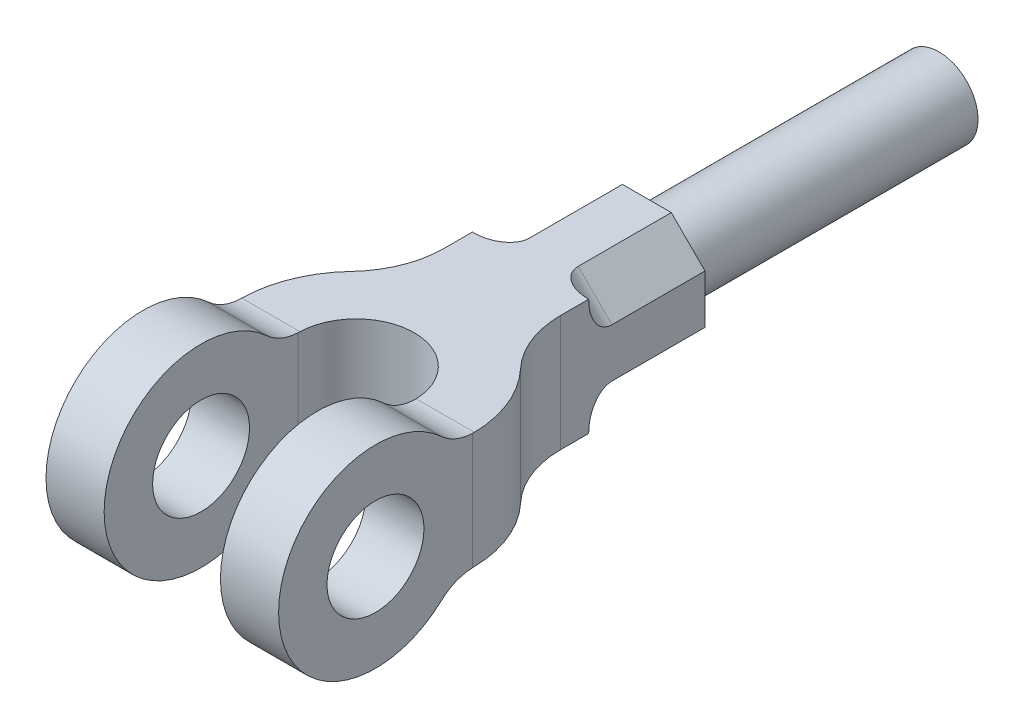
from build123d import *

# Parameters (mm, degrees)
SKETCH1_W           = 120
SKETCH1_H           = 250
BOSS_EXTRUDE1_DEPTH = 100
CUT_EXTRUDE1_DEPTH  = 295.78805946
CUT_EXTRUDE2_DEPTH  = 295.78805946
SKETCH5_R           = 25
CUT_EXTRUDE3_DEPTH  = 295.7880595
CUT_EXTRUDE5_DEPTH  = 60
CUT_EXTRUDE6_DEPTH  = 60
CUT_EXTRUDE7_DEPTH  = 60
CUT_EXTRUDE8_DEPTH  = 60
SKETCH10_R          = 20.176522507
BOSS_EXTRUDE2_DEPTH = 150.7
FILLET1_R           = 12
FILLET2_R           = 12
FILLET3_R           = 12
FILLET4_R           = 12


with BuildPart() as part:
    # Sketch1 → Boss-Extrude1 (new body)
    with BuildSketch(Plane(origin=(0, 0, 0), x_dir=(1, 0, 0), z_dir=(0, 1, 0))):
        with Locations((60, -125)):
            Rectangle(SKETCH1_W, SKETCH1_H)
    extrude(amount=BOSS_EXTRUDE1_DEPTH)

    # Sketch2 → Cut-Extrude1 (cut, through all)
    with BuildSketch(Plane(origin=(0, 100, 0), x_dir=(1, 0, 0), z_dir=(0, 1, 0))):
        with BuildLine():
            ThreePointArc((90, -150), (60, -120), (30, -150))
            Line((30, -150), (30, -250))
            Line((30, -250), (90, -250))
            Line((90, -250), (90, -150))
        make_face()
        with BuildLine():
            Line((120, 0), (90, 0))
            Line((90, 0), (90, -74.501655647))
            ThreePointArc((90, -74.501655647), (93.533981136, -92.965379294), (103.636363636, -108.819084899))
            ThreePointArc((103.636363636, -108.819084899), (115.759222637, -127.843531624), (120, -150))
            Line((120, -150), (120, 0))
        make_face()
        with BuildLine():
            Line((30, -74.501655647), (30, 0))
            Line((30, 0), (0, 0))
            Line((0, 0), (0, -150.000000078))
            ThreePointArc((0, -150.000000078), (4.240777349, -127.84353166), (16.363636364, -108.819084899))
            ThreePointArc((16.363636364, -108.819084899), (26.466018864, -92.965379294), (30, -74.501655647))
        make_face()
    extrude(amount=-CUT_EXTRUDE1_DEPTH, mode=Mode.SUBTRACT)

    # Sketch4 → Cut-Extrude2 (cut, through all)
    with BuildSketch(Plane(origin=(120, 0, 0), x_dir=(0, 0, -1), z_dir=(1, 0, 0))):
        with BuildLine():
            ThreePointArc((-250, 50), (-235.355339059, 85.355339059), (-200, 100))
            Line((-200, 100), (-250, 100))
            Line((-250, 100), (-250, 50))
        make_face()
        with BuildLine():
            Line((-150, 100), (-200, 100))
            ThreePointArc((-200, 100), (-181.742581416, 96.547466813), (-166.006536576, 86.666666667))
            ThreePointArc((-166.006536576, 86.666666667), (-158.59772436, 81.911652295), (-150, 80.019617425))
            Line((-150, 80.019617425), (-150, 100))
        make_face()
        with BuildLine():
            Line((-108.819084899, 100), (-150, 100))
            Line((-150, 100), (-150, 80.019617425))
            ThreePointArc((-150, 80.019617425), (-149.504999586, 80.004904837), (-149.009804864, 80))
            Line((-149.009804864, 80), (0, 80))
            Line((0, 80), (0, 100))
            Line((0, 100), (-74.501655647, 100))
            Line((-74.501655647, 100), (-108.819084899, 100))
        make_face()
        with BuildLine():
            ThreePointArc((-200, 0), (-235.355339059, 14.644660941), (-250, 50))
            Line((-250, 50), (-250, 0))
            Line((-250, 0), (-200, 0))
        make_face()
        with BuildLine():
            ThreePointArc((-166.006536576, 13.333333333), (-181.742581416, 3.452533187), (-200, 0))
            Line((-200, 0), (-150, 0))
            Line((-150, 0), (-150, 19.980382575))
            ThreePointArc((-150, 19.980382575), (-158.59772436, 18.088347705), (-166.006536576, 13.333333333))
        make_face()
        with BuildLine():
            ThreePointArc((-149.009804864, 20), (-149.504999586, 19.995095163), (-150, 19.980382575))
            Line((-150, 19.980382575), (-150, 0))
            Line((-150, 0), (-108.819084899, 0))
            Line((-108.819084899, 0), (-74.501655647, 0))
            Line((-74.501655647, 0), (0, 0))
            Line((0, 0), (0, 20))
            Line((0, 20), (-149.009804864, 20))
        make_face()
    extrude(amount=-CUT_EXTRUDE2_DEPTH, mode=Mode.SUBTRACT)

    # Sketch5 → Cut-Extrude3 (cut, through all)
    with BuildSketch(Plane(origin=(120, 0, 0), x_dir=(0, 0, -1), z_dir=(1, 0, 0))):
        with Locations((-200, 50)):
            Circle(SKETCH5_R)
    extrude(amount=-CUT_EXTRUDE3_DEPTH, mode=Mode.SUBTRACT)

    # Sketch6 → Cut-Extrude5 (cut)
    with BuildSketch(Plane(origin=(0, 0, 0), x_dir=(-1, 0, 0), z_dir=(0, 0, -1))):
        Polygon((-30, 62.6), (-30, 80), (-47.4, 80), align=None)
    extrude(amount=-CUT_EXTRUDE5_DEPTH, mode=Mode.SUBTRACT)

    # Sketch7 → Cut-Extrude6 (cut)
    with BuildSketch(Plane(origin=(0, 0, 0), x_dir=(-1, 0, 0), z_dir=(0, 0, -1))):
        Polygon((-72.6, 80), (-90, 80), (-90, 62.6), align=None)
    extrude(amount=-CUT_EXTRUDE6_DEPTH, mode=Mode.SUBTRACT)

    # Sketch8 → Cut-Extrude7 (cut)
    with BuildSketch(Plane(origin=(0, 0, 0), x_dir=(-1, 0, 0), z_dir=(0, 0, -1))):
        Polygon((-90, 37.4), (-90, 20), (-72.6, 20), align=None)
    extrude(amount=-CUT_EXTRUDE7_DEPTH, mode=Mode.SUBTRACT)

    # Sketch9 → Cut-Extrude8 (cut)
    with BuildSketch(Plane(origin=(0, 0, 0), x_dir=(-1, 0, 0), z_dir=(0, 0, -1))):
        Polygon((-30, 37.4), (-30, 20), (-47.4, 20), align=None)
    extrude(amount=-CUT_EXTRUDE8_DEPTH, mode=Mode.SUBTRACT)

    # Sketch10 → Boss-Extrude2 (add)
    with BuildSketch(Plane(origin=(0, 0, 0), x_dir=(-1, 0, 0), z_dir=(0, 0, -1))):
        with Locations((-60, 50)):
            Circle(SKETCH10_R)
    extrude(amount=BOSS_EXTRUDE2_DEPTH)

    # Fillet1
    fillet1_edges = [part.edges().sort_by_distance(p)[0] for p in [
        (81.3, 28.7, 60),
    ]]
    fillet(fillet1_edges, radius=FILLET1_R)

    # Fillet2
    fillet2_edges = [part.edges().sort_by_distance(p)[0] for p in [
        (81.3, 71.3, 60),
    ]]
    fillet(fillet2_edges, radius=FILLET2_R)

    # Fillet3
    fillet3_edges = [part.edges().sort_by_distance(p)[0] for p in [
        (38.7, 71.3, 60),
    ]]
    fillet(fillet3_edges, radius=FILLET3_R)

    # Fillet4
    fillet4_edges = [part.edges().sort_by_distance(p)[0] for p in [
        (38.7, 28.7, 60),
    ]]
    fillet(fillet4_edges, radius=FILLET4_R)


solid = part.part
